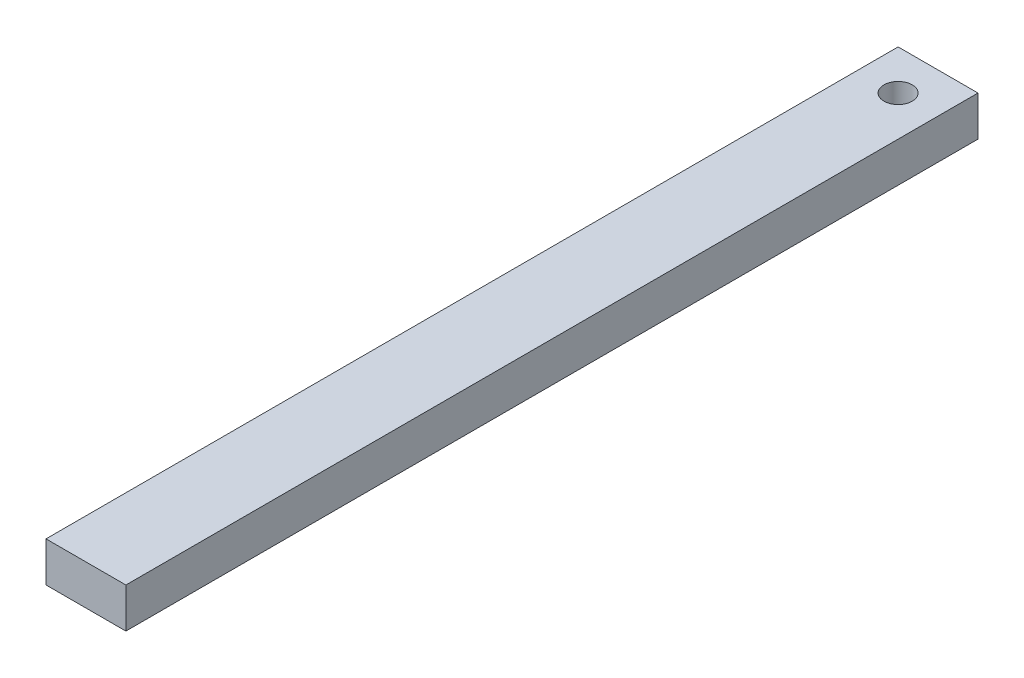
from build123d import *

# Parameters (mm, degrees)
SKETCH1_W               = 19.05
SKETCH1_H               = 9.525
BOSS_EXTRUDE1_DEPTH     = 203.2
F_1_4_CLEARANCE_HOLE1_D = 6.7564


with BuildPart() as part:
    # Sketch1 → Boss-Extrude1 (new body)
    with BuildSketch(Plane.XY):
        Rectangle(SKETCH1_W, SKETCH1_H)
    extrude(amount=BOSS_EXTRUDE1_DEPTH)

    # 1/4 Clearance Hole1 (through all)
    with Locations(Plane(origin=(0, 4.7625, 0), x_dir=(1, 0, 0), z_dir=(0, 1, 0))):
        with Locations((0, -9.525)):
            Hole(F_1_4_CLEARANCE_HOLE1_D / 2)


solid = part.part
